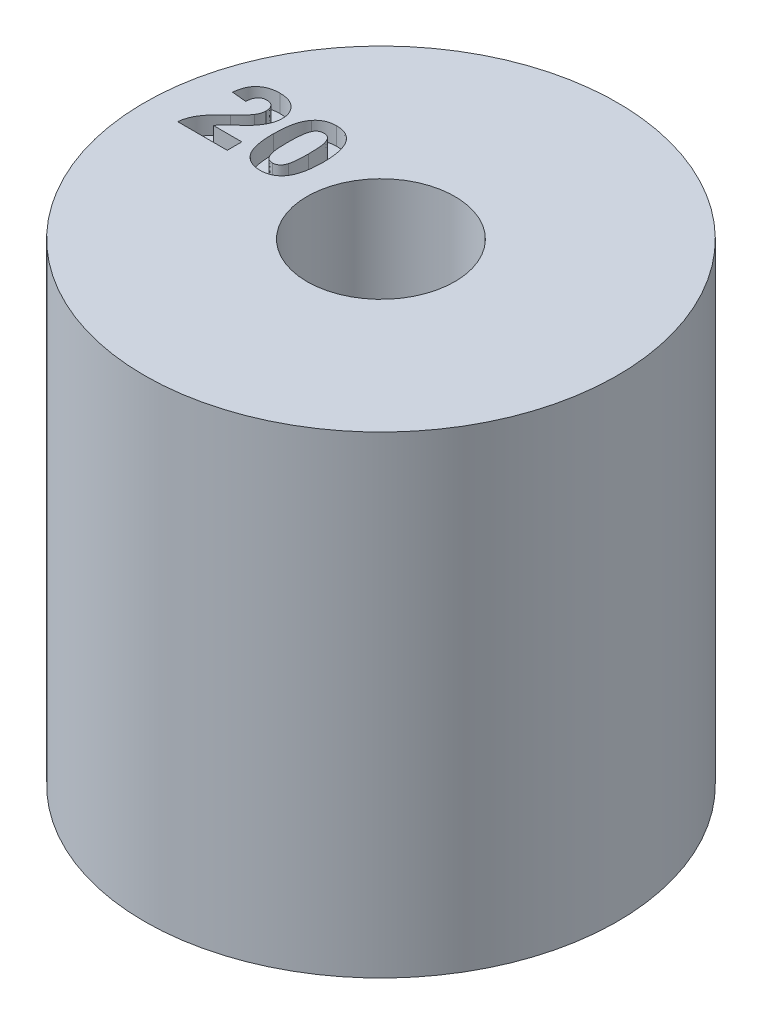
from build123d import *

# Parameters (mm, degrees)
SKETCH1_R           = 8
SKETCH1_R_2         = 2.5
BOSS_EXTRUDE1_DEPTH = 16
CUT_EXTRUDE1_DEPTH  = 0.6


with BuildPart() as part:
    # Sketch1 → Boss-Extrude1 (new body)
    with BuildSketch(Plane(origin=(0, 0, 0), x_dir=(1, 0, 0), z_dir=(0, 1, 0))):
        with Locations(Location((0, 0, 0), (0, 0, 270))):
            Circle(SKETCH1_R)
        with Locations(Location((0, 0, 0), (0, 0, 270))):
            Circle(SKETCH1_R_2, mode=Mode.SUBTRACT)
    extrude(amount=BOSS_EXTRUDE1_DEPTH)

    # Sketch2 → Cut-Extrude1 (cut)
    # profile 1 of 2: a face of its own
    with BuildSketch(Plane(origin=(0, 16, 0), x_dir=(1, 0, 0), z_dir=(0, 1, 0))):
        with BuildLine():
            Line((-5.201191177, 0.493907439), (-5.201191177, 0))
            Line((-5.201191177, 0), (-6.880476471, 0))
            add(Edge.make_bspline(
                [(-6.880476471, 0), (-6.8747908, 0.042211557), (-6.863422646, 0.126611002), (-6.828276379, 0.249897348), (-6.781368151, 0.370203757), (-6.730458179, 0.468103973), (-6.679822573, 0.546910278), (-6.633880885, 0.611484773), (-6.579074138, 0.680189263), (-6.516197637, 0.753578386), (-6.445598864, 0.831881553), (-6.366751107, 0.91480765), (-6.279278248, 1.001959687), (-6.217739534, 1.061140209), (-6.185919134, 1.091741236)],
                knots=[0, 0, 0, 0, 1.156289446, 2.311930546, 3.473459201, 4.661751613, 5.303057008, 6.018253237, 6.81459331, 7.690699809, 8.644447906, 9.679642995, 10.800191253, 12, 12, 12, 12], degree=3))
            add(Edge.make_bspline(
                [(-6.185919134, 1.091741236), (-6.160526091, 1.116252474), (-6.112185216, 1.162914653), (-6.043347716, 1.229733002), (-5.982832461, 1.291158057), (-5.929374159, 1.345598032), (-5.884207774, 1.394439107), (-5.846739183, 1.436914239), (-5.81649385, 1.473196401), (-5.800112952, 1.496213827), (-5.79285113, 1.50641769)],
                knots=[0, 0, 0, 0, 1.480720495, 2.818855715, 4.024636094, 5.098235712, 6.019786162, 6.815086302, 7.474715479, 8, 8, 8, 8], degree=3))
            add(Edge.make_bspline(
                [(-5.79285113, 1.50641769), (-5.777980691, 1.531119078), (-5.749297337, 1.578765193), (-5.71784366, 1.65368957), (-5.698963991, 1.72859847), (-5.69637319, 1.778652169), (-5.695098616, 1.803276641)],
                knots=[0, 0, 0, 0, 1.0911822, 2.104764037, 3.067617678, 4, 4, 4, 4], degree=3))
            add(Edge.make_bspline(
                [(-5.695098616, 1.803276641), (-5.696023639, 1.828901714), (-5.69777371, 1.877382354), (-5.712448356, 1.945797502), (-5.738471459, 2.004610013), (-5.774300484, 2.054000414), (-5.819606357, 2.092697605), (-5.87257024, 2.121291072), (-5.93396744, 2.137099533), (-5.977121014, 2.139178839), (-5.99967487, 2.140265571)],
                knots=[0, 0, 0, 0, 1.193122327, 2.257294386, 3.237245624, 4.168877528, 5.075331632, 5.990371598, 6.949684428, 8, 8, 8, 8], degree=3))
            add(Edge.make_bspline(
                [(-5.99967487, 2.140265571), (-6.022076355, 2.139250644), (-6.065351187, 2.137290025), (-6.126854112, 2.120162329), (-6.180657821, 2.090512484), (-6.219001205, 2.056723625), (-6.24490398, 2.023866415), (-6.262553227, 1.99523352), (-6.277765501, 1.962697771), (-6.291244844, 1.926625466), (-6.301892001, 1.886603358), (-6.31046656, 1.842936257), (-6.317376415, 1.79538917), (-6.31957387, 1.762312023), (-6.320714706, 1.745139619)],
                knots=[0, 0, 0, 0, 1.402788338, 2.709884207, 3.961032948, 5.225417836, 5.883680772, 6.578928686, 7.329201998, 8.132101139, 8.990263233, 9.922304639, 10.921339128, 12, 12, 12, 12], degree=3))
            Line((-6.320714706, 1.745139619), (-6.814622145, 1.793501389))
            add(Edge.make_bspline(
                [(-6.814622145, 1.793501389), (-6.810651206, 1.826846367), (-6.802952189, 1.891496951), (-6.783739164, 1.98435748), (-6.759406578, 2.07002551), (-6.728794418, 2.148342056), (-6.693167919, 2.219805136), (-6.650709834, 2.283342401), (-6.602903694, 2.339657665), (-6.549708184, 2.388720956), (-6.491461483, 2.430688356), (-6.430342023, 2.4681507), (-6.365155357, 2.498881731), (-6.296619193, 2.524208718), (-6.224764504, 2.544449844), (-6.149258951, 2.557833001), (-6.070568528, 2.567246766), (-6.016854117, 2.567955993), (-5.989385132, 2.568318685)],
                knots=[0, 0, 0, 0, 1.270971563, 2.464210789, 3.586263665, 4.638946707, 5.643716971, 6.603612468, 7.52484387, 8.434700188, 9.336036235, 10.239171475, 11.145359471, 12.059630629, 13.003312604, 13.96741569, 14.960557767, 16, 16, 16, 16], degree=3))
            add(Edge.make_bspline(
                [(-5.989385132, 2.568318685), (-5.959522797, 2.567744746), (-5.901362149, 2.566626929), (-5.816457929, 2.557395984), (-5.736696514, 2.541300493), (-5.661380575, 2.519979738), (-5.591283565, 2.491514971), (-5.52582137, 2.457102251), (-5.466024249, 2.415435546), (-5.411000844, 2.368787118), (-5.361814324, 2.317488973), (-5.318731382, 2.262770829), (-5.282636636, 2.204670808), (-5.2523476, 2.143897083), (-5.229858196, 2.07947172), (-5.213471438, 2.012285542), (-5.202606358, 1.942025114), (-5.201668121, 1.894038835), (-5.201191177, 1.869645453)],
                knots=[0, 0, 0, 0, 1.210756838, 2.35810096, 3.457354827, 4.507168606, 5.527358126, 6.519769748, 7.499700793, 8.476517721, 9.440526811, 10.376769937, 11.295256217, 12.209626307, 13.124630862, 14.055668209, 15.011616881, 16, 16, 16, 16], degree=3))
            add(Edge.make_bspline(
                [(-5.201191177, 1.869645453), (-5.201819544, 1.841649601), (-5.203066129, 1.786110126), (-5.215001253, 1.704006189), (-5.233235798, 1.623795559), (-5.260185021, 1.545282208), (-5.294345253, 1.466582783), (-5.33837861, 1.387520636), (-5.389504669, 1.305711393), (-5.429534357, 1.252818147), (-5.450202844, 1.225507834)],
                knots=[0, 0, 0, 0, 0.953409949, 1.89141903, 2.821310783, 3.752688675, 4.715703262, 5.740811754, 6.833515735, 8, 8, 8, 8], degree=3))
            add(Edge.make_bspline(
                [(-5.450202844, 1.225507834), (-5.458014625, 1.215668873), (-5.474745648, 1.1945961), (-5.503209515, 1.162284261), (-5.536196689, 1.126989547), (-5.57324124, 1.088051322), (-5.615566823, 1.046848496), (-5.66165056, 1.001657997), (-5.713520271, 0.954791471), (-5.767244721, 0.905079826), (-5.821202695, 0.85669618), (-5.870797853, 0.810742443), (-5.915846758, 0.770083256), (-5.9542514, 0.732474044), (-5.988270729, 0.70048161), (-6.016678576, 0.672465419), (-6.040006519, 0.649103719), (-6.072150923, 0.612688756), (-6.11305103, 0.563437504), (-6.141825927, 0.51637654), (-6.155564406, 0.493907439)],
                knots=[0, 0, 0, 0, 0.665555651, 1.425465941, 2.280616993, 3.225313414, 4.272635571, 5.410053715, 6.644756443, 7.976022804, 9.288331007, 10.484517221, 11.558462543, 12.503158964, 13.33222979, 14.032602617, 14.617328242, 15.080653724, 16.606167857, 18, 18, 18, 18], degree=3))
            Line((-6.155564406, 0.493907439), (-5.201191177, 0.493907439))
        make_face()
    # profile 2 of 2: a face of its own
    with BuildSketch(Plane(origin=(0, 16, 0), x_dir=(1, 0, 0), z_dir=(0, 1, 0))):
        with BuildLine():
            add(Edge.make_bspline(
                [(-4.065204066, 2.568318685), (-4.034632517, 2.567581319), (-3.975113215, 2.566145752), (-3.888387038, 2.553429227), (-3.806730026, 2.533038989), (-3.730148171, 2.504215943), (-3.658713219, 2.466787551), (-3.592900997, 2.420593868), (-3.53127342, 2.367019595), (-3.495685746, 2.325445072), (-3.477660008, 2.304386897)],
                knots=[0, 0, 0, 0, 1.098584764, 2.138818609, 3.143716932, 4.11936356, 5.073598562, 6.034819447, 7.004603936, 8, 8, 8, 8], degree=3))
            add(Edge.make_bspline(
                [(-3.477660008, 2.304386897), (-3.467348998, 2.290975621), (-3.446306033, 2.263605557), (-3.417965889, 2.219378557), (-3.390720697, 2.172463466), (-3.366938303, 2.12173102), (-3.34416563, 2.068061595), (-3.323061838, 2.011332903), (-3.304738073, 1.951076232), (-3.287496481, 1.888062066), (-3.273446166, 1.821306278), (-3.260462374, 1.751529537), (-3.249698227, 1.678415512), (-3.241210062, 1.602198128), (-3.23362929, 1.522993346), (-3.229475394, 1.440423209), (-3.226074239, 1.354672088), (-3.225734326, 1.296339402), (-3.225561419, 1.266666787)],
                knots=[0, 0, 0, 0, 0.746761706, 1.524009783, 2.317797294, 3.140957436, 3.996208027, 4.892396322, 5.812273159, 6.776774596, 7.776522781, 8.823794876, 9.910947555, 11.039215469, 12.21036455, 13.424061321, 14.689674014, 16, 16, 16, 16], degree=3))
            add(Edge.make_bspline(
                [(-3.225561419, 1.266666787), (-3.225731721, 1.236994104), (-3.22606553, 1.178832679), (-3.229488074, 1.093253592), (-3.233632993, 1.010855611), (-3.241192377, 0.931646599), (-3.249761813, 0.855444366), (-3.260218207, 0.7824123), (-3.274179047, 0.712956184), (-3.288008334, 0.646306867), (-3.305148845, 0.583024405), (-3.324296046, 0.522875792), (-3.344551622, 0.465439923), (-3.367853762, 0.411701408), (-3.392489474, 0.360906182), (-3.419329208, 0.313512222), (-3.447985793, 0.269011129), (-3.469232336, 0.241496672), (-3.479717956, 0.227917704)],
                knots=[0, 0, 0, 0, 1.308387162, 2.564569672, 3.776470597, 4.945886788, 6.07248526, 7.158029334, 8.197718558, 9.195987466, 10.159061779, 11.087054987, 11.979325145, 12.84323098, 13.668471539, 14.467659354, 15.243757377, 16, 16, 16, 16], degree=3))
            add(Edge.make_bspline(
                [(-3.479717956, 0.227917704), (-3.49757877, 0.207040027), (-3.532836879, 0.165826486), (-3.593782384, 0.112696511), (-3.659485503, 0.067458174), (-3.730794634, 0.030773581), (-3.807002283, 0.001751652), (-3.888792925, -0.017987933), (-3.975282175, -0.030730346), (-4.034802566, -0.032184446), (-4.065204066, -0.032927163)],
                knots=[0, 0, 0, 0, 0.991631672, 1.957528776, 2.911425699, 3.867574088, 4.848108326, 5.850523106, 6.902101959, 8, 8, 8, 8], degree=3))
            add(Edge.make_bspline(
                [(-4.065204066, -0.032927163), (-4.095953044, -0.032042372), (-4.156207261, -0.030308578), (-4.244181028, -0.016564298), (-4.327804132, 0.005453952), (-4.406776367, 0.036890143), (-4.480984737, 0.077629139), (-4.551008989, 0.126463962), (-4.615325677, 0.185605864), (-4.665678627, 0.240663712), (-4.702516996, 0.290412527), (-4.728498868, 0.331666024), (-4.753607578, 0.375808913), (-4.775279413, 0.424221321), (-4.796660604, 0.475471355), (-4.81559762, 0.530663523), (-4.832304974, 0.589323227), (-4.847992116, 0.651182608), (-4.861072881, 0.716667759), (-4.873105266, 0.785585429), (-4.882587433, 0.858228708), (-4.890994352, 0.934192982), (-4.896913304, 1.013657574), (-4.901720248, 1.096492443), (-4.904130599, 1.182962741), (-4.904604812, 1.241798805), (-4.904846713, 1.271811656)],
                knots=[0, 0, 0, 0, 1.257818097, 2.464759732, 3.634271214, 4.790227596, 5.933394726, 7.09190477, 8.274482889, 9.50191983, 10.139172818, 10.805000628, 11.49619854, 12.215266328, 12.973768034, 13.768328009, 14.601232062, 15.469317089, 16.379095881, 17.333267023, 18.331755967, 19.376479622, 20.460535752, 21.592206075, 22.771760786, 24, 24, 24, 24], degree=3))
            add(Edge.make_bspline(
                [(-4.904846713, 1.271811656), (-4.904677771, 1.30131296), (-4.904346666, 1.359131724), (-4.900899164, 1.444366164), (-4.89680902, 1.526425799), (-4.889167357, 1.605454257), (-4.880718114, 1.681331098), (-4.870067979, 1.754156361), (-4.856454248, 1.823553259), (-4.841631842, 1.889798769), (-4.825372676, 1.953127497), (-4.806047477, 2.013010085), (-4.785994352, 2.070352227), (-4.762419859, 2.1238041), (-4.737935395, 2.174492418), (-4.71107466, 2.221877497), (-4.68242336, 2.266380826), (-4.661176134, 2.293894993), (-4.650690177, 2.307473818)],
                knots=[0, 0, 0, 0, 1.304469132, 2.556591843, 3.77188756, 4.93702727, 6.066781583, 7.147865049, 8.190466662, 9.19316792, 10.149665317, 11.080258032, 11.975027628, 12.834388201, 13.661940433, 14.463366943, 15.241638981, 16, 16, 16, 16], degree=3))
            add(Edge.make_bspline(
                [(-4.650690177, 2.307473818), (-4.632830345, 2.328353504), (-4.597574174, 2.36957101), (-4.536614475, 2.42267196), (-4.470838714, 2.468105566), (-4.399320892, 2.504351061), (-4.323287943, 2.533770868), (-4.24160434, 2.553352934), (-4.15512887, 2.566128978), (-4.095606551, 2.567578372), (-4.065204066, 2.568318685)],
                knots=[0, 0, 0, 0, 0.991667276, 1.957599061, 2.911530233, 3.873218945, 4.847995157, 5.850445929, 6.902062539, 8, 8, 8, 8], degree=3))
        make_face()
        with BuildLine():
            add(Edge.make_bspline(
                [(-4.065204066, 2.140265571), (-4.080865258, 2.139547914), (-4.111844526, 2.138128322), (-4.156872202, 2.127607772), (-4.199397129, 2.11024657), (-4.239624303, 2.086010558), (-4.276664807, 2.052294931), (-4.308041433, 2.007089512), (-4.335138951, 1.951614966), (-4.34869977, 1.91015003), (-4.355889174, 1.888166982)],
                knots=[0, 0, 0, 0, 0.899391665, 1.779078861, 2.640979247, 3.529945348, 4.464599804, 5.495588918, 6.672261578, 8, 8, 8, 8], degree=3))
            add(Edge.make_bspline(
                [(-4.355889174, 1.888166982), (-4.36037908, 1.871580164), (-4.370029077, 1.835930703), (-4.380981422, 1.777807266), (-4.390013596, 1.711843317), (-4.397640354, 1.638054188), (-4.403846927, 1.55640083), (-4.407669149, 1.466831288), (-4.410310999, 1.369408324), (-4.410724275, 1.301825396), (-4.410939274, 1.266666787)],
                knots=[0, 0, 0, 0, 0.658986521, 1.416336438, 2.266694271, 3.212608458, 4.261595115, 5.407496572, 6.651304179, 8, 8, 8, 8], degree=3))
            add(Edge.make_bspline(
                [(-4.410939274, 1.266666787), (-4.410646162, 1.231682108), (-4.410084316, 1.164622346), (-4.408488861, 1.068370999), (-4.403960133, 0.980755148), (-4.399427314, 0.901425634), (-4.391877704, 0.830632417), (-4.384284366, 0.768184332), (-4.373818199, 0.714507873), (-4.359537719, 0.656125076), (-4.337940323, 0.595018216), (-4.308309342, 0.533370362), (-4.276534794, 0.483870022), (-4.239110074, 0.448428109), (-4.198605562, 0.424652805), (-4.156594262, 0.407183839), (-4.111607589, 0.397381376), (-4.08085453, 0.395886636), (-4.065204066, 0.395125952)],
                knots=[0, 0, 0, 0, 1.613353868, 3.092528792, 4.438413522, 5.658843895, 6.755779493, 7.721003256, 8.558527904, 9.275869043, 10.491421475, 11.538327284, 12.426656321, 13.187490948, 13.890032692, 14.581719216, 15.278226227, 16, 16, 16, 16], degree=3))
            add(Edge.make_bspline(
                [(-4.065204066, 0.395125952), (-4.049362763, 0.39580721), (-4.018361939, 0.397140407), (-3.973275268, 0.408011736), (-3.930689794, 0.424850902), (-3.890731789, 0.449581057), (-3.853725978, 0.483065826), (-3.822372258, 0.528311867), (-3.795267496, 0.583773568), (-3.781707778, 0.625240457), (-3.774518959, 0.64722454)],
                knots=[0, 0, 0, 0, 0.909107913, 1.77908945, 2.650019014, 3.530482969, 4.465025013, 5.495890128, 6.672421267, 8, 8, 8, 8], degree=3))
            add(Edge.make_bspline(
                [(-3.774518959, 0.64722454), (-3.770035547, 0.663812674), (-3.760443436, 0.699302442), (-3.749413046, 0.757064046), (-3.74035642, 0.822686172), (-3.732802177, 0.896139634), (-3.726534554, 0.977616614), (-3.722744778, 1.067017224), (-3.720100443, 1.164268176), (-3.719684656, 1.23167965), (-3.719468859, 1.266666787)],
                knots=[0, 0, 0, 0, 0.66114423, 1.414496391, 2.261103113, 3.210114492, 4.255954433, 5.405607896, 6.653488082, 8, 8, 8, 8], degree=3))
            add(Edge.make_bspline(
                [(-3.719468859, 1.266666787), (-3.719444998, 1.301655129), (-3.719399258, 1.368727195), (-3.72242972, 1.465100715), (-3.725403854, 1.552974651), (-3.73146862, 1.632176863), (-3.737543018, 1.702974837), (-3.746592362, 1.765014114), (-3.755708864, 1.818978477), (-3.771288988, 1.877239612), (-3.792462503, 1.938522082), (-3.821389529, 2.000810527), (-3.854088534, 2.049846851), (-3.891241998, 2.085891007), (-3.931547145, 2.110188897), (-3.973661547, 2.127710872), (-4.01857136, 2.13811097), (-4.049545478, 2.139542087), (-4.065204066, 2.140265571)],
                knots=[0, 0, 0, 0, 1.611146624, 3.088541111, 4.440175916, 5.659517762, 6.746360572, 7.711365618, 8.546319149, 9.264661039, 10.486047304, 11.528122518, 12.419721574, 13.184982167, 13.89070983, 14.574167459, 15.279187713, 16, 16, 16, 16], degree=3))
        make_face(mode=Mode.SUBTRACT)
    extrude(amount=-CUT_EXTRUDE1_DEPTH, mode=Mode.SUBTRACT)


solid = part.part
